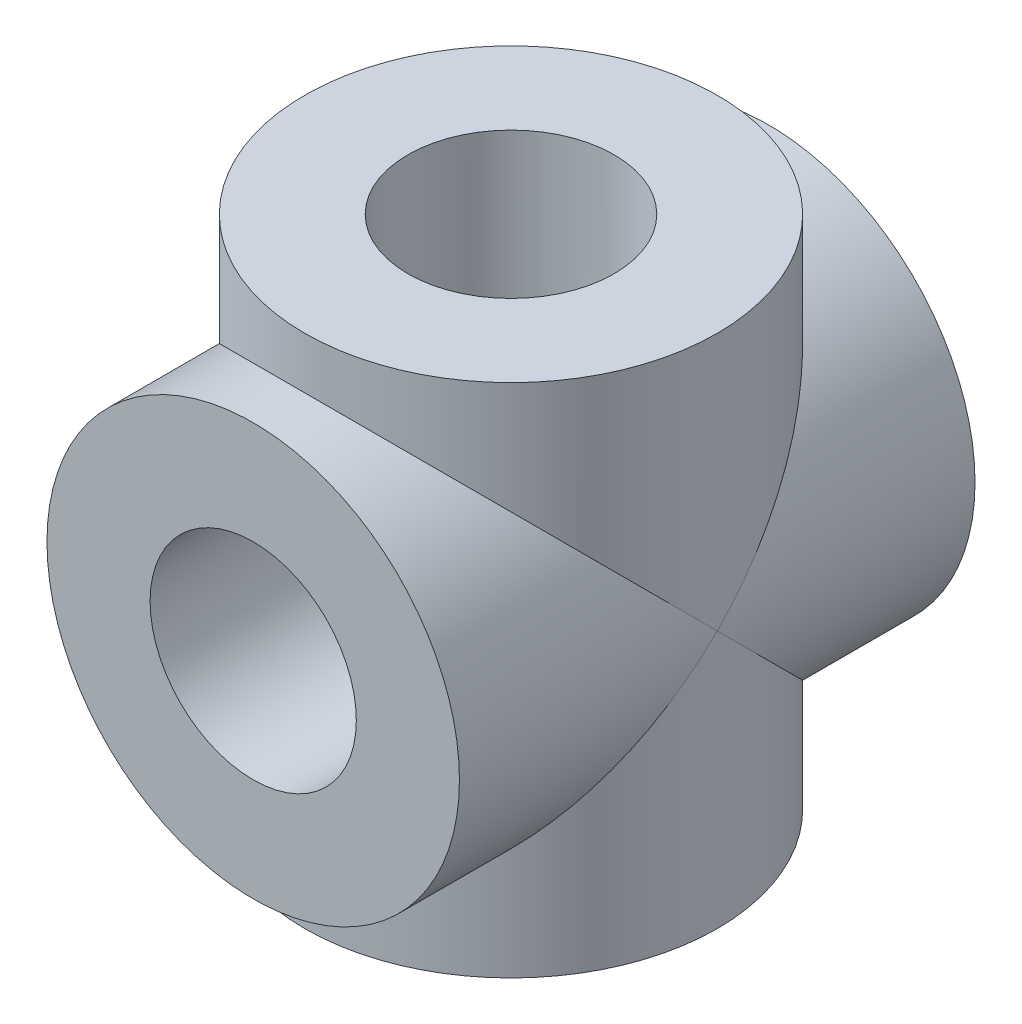
from build123d import *

# Parameters (mm, degrees)
SKETCH1_R               = 4
SKETCH1_R_2             = 2
BOSS_EXTRUDE1_DEPTH     = 5
SKETCH2_R               = 4
SKETCH2_R_2             = 2
BOSS_EXTRUDE2_DEPTH     = 5
CUT_EXTRUDE1_DEPTH      = 9.124038528
CUT_EXTRUDE1_DEPTH_BACK = 9.124038528
SKETCH1_2_R             = 2
CUT_EXTRUDE2_DEPTH      = 9.124038528
CUT_EXTRUDE2_DEPTH_BACK = 9.124038528
SKETCH2_2_R             = 2


with BuildPart() as part:
    # Sketch1 → Boss-Extrude1 (new, symmetric)
    with BuildSketch(Plane.XY):
        Circle(SKETCH1_R)
        Circle(SKETCH1_R_2, mode=Mode.SUBTRACT)
    extrude(amount=BOSS_EXTRUDE1_DEPTH, both=True)

    # Sketch2 → Boss-Extrude2 (add, symmetric)
    with BuildSketch(Plane(origin=(0, 0, 0), x_dir=(1, 0, 0), z_dir=(0, 1, 0))):
        Circle(SKETCH2_R)
        Circle(SKETCH2_R_2, mode=Mode.SUBTRACT)
    extrude(amount=BOSS_EXTRUDE2_DEPTH, both=True)

    # Sketch1<2> → Cut-Extrude1 (cut, two sides: drawn at the far end of the back side and taken through both)
    with BuildSketch(Plane.XY.offset(-CUT_EXTRUDE1_DEPTH_BACK)):
        Circle(SKETCH1_2_R)
    extrude(amount=CUT_EXTRUDE1_DEPTH + CUT_EXTRUDE1_DEPTH_BACK, mode=Mode.SUBTRACT)

    # Sketch2<2> → Cut-Extrude2 (cut, two sides: drawn at the far end of the back side and taken through both)
    with BuildSketch(Plane(origin=(0, 0, 0), x_dir=(1, 0, 0), z_dir=(0, 1, 0)).offset(-CUT_EXTRUDE2_DEPTH_BACK)):
        Circle(SKETCH2_2_R)
    extrude(amount=CUT_EXTRUDE2_DEPTH + CUT_EXTRUDE2_DEPTH_BACK, mode=Mode.SUBTRACT)


solid = part.part
